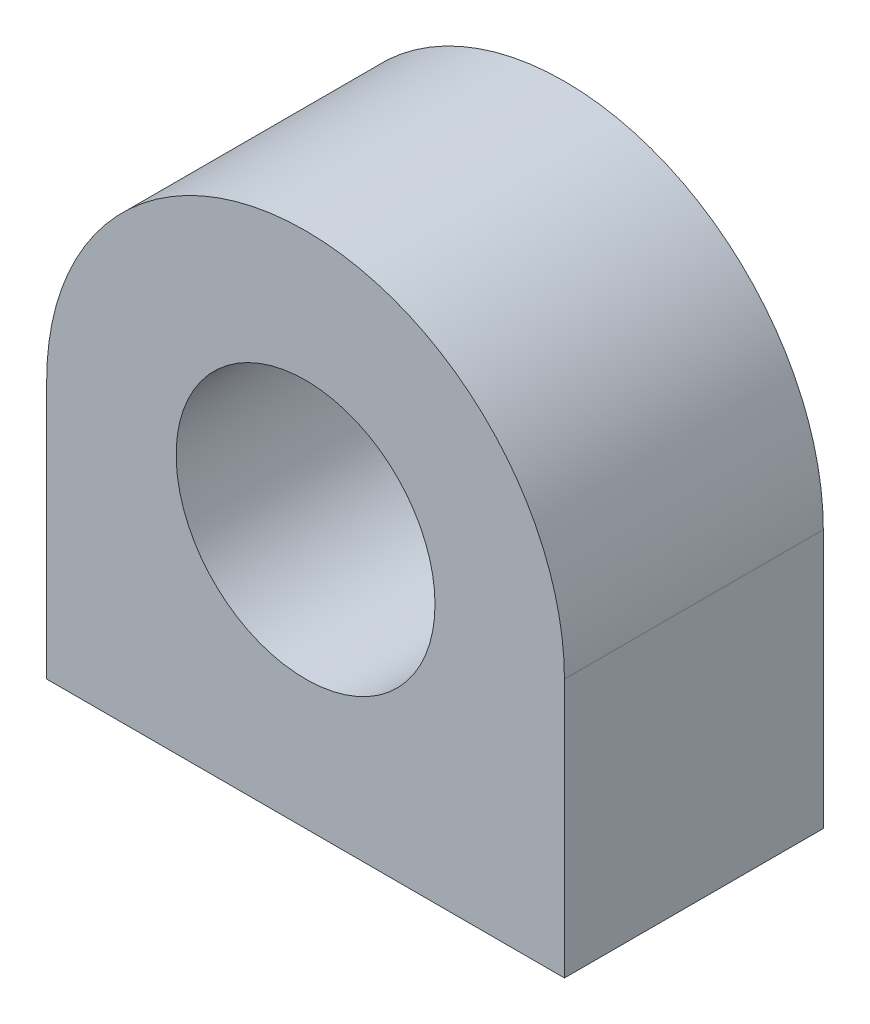
from build123d import *

# Parameters (mm, degrees)
SKETCH1_R           = 5
BOSS_EXTRUDE1_DEPTH = 10


with BuildPart() as part:
    # Sketch1 → Boss-Extrude1 (new body)
    with BuildSketch(Plane.XY):
        with BuildLine():
            Line((0, 0), (20, 0))
            Line((20, 0), (20, 10))
            ThreePointArc((20, 10), (10, 20), (0, 10))
            Line((0, 10), (0, 0))
        make_face()
        with Locations((10, 10)):
            Circle(SKETCH1_R, mode=Mode.SUBTRACT)
    extrude(amount=BOSS_EXTRUDE1_DEPTH)


solid = part.part
